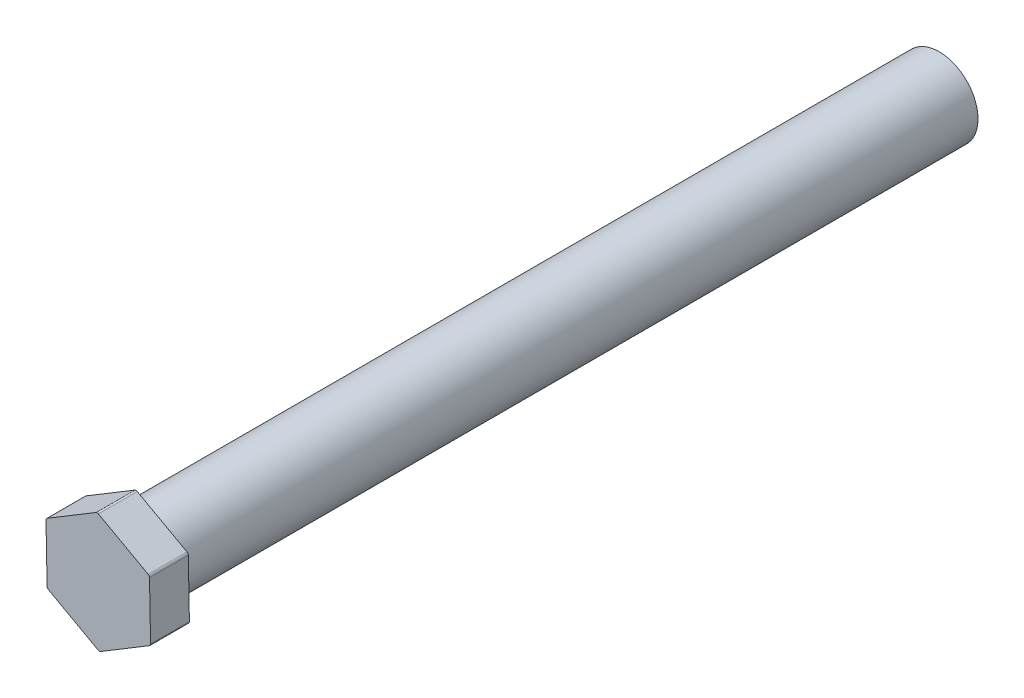
from build123d import *

# Parameters (mm, degrees)
SKETCH1_R           = 3
BOSS_EXTRUDE1_DEPTH = 62
BOSS_EXTRUDE2_DEPTH = 3


with BuildPart() as part:
    # Sketch1 → Boss-Extrude1 (new body)
    with BuildSketch(Plane.XY):
        with Locations((-43.2, 0)):
            Circle(SKETCH1_R)
    extrude(amount=-BOSS_EXTRUDE1_DEPTH)

    # Sketch2 → Boss-Extrude2 (add)
    with BuildSketch(Plane.XY):
        with BuildLine():
            Line((-47.054399712, -2.442285905), (-43.212081089, -4.563004671))
            ThreePointArc((-43.212081089, -4.563004671), (-43.111583363, -4.58786779), (-43.012118219, -4.559151019))
            Line((-43.012118219, -4.559151019), (-39.254362582, -2.291964865))
            ThreePointArc((-39.254362582, -2.291964865), (-39.182581626, -2.217362841), (-39.157718507, -2.116865114))
            Line((-39.157718507, -2.116865114), (-39.242281493, 2.271039806))
            ThreePointArc((-39.242281493, 2.271039806), (-39.270998264, 2.370504949), (-39.345600288, 2.442285905))
            Line((-39.345600288, 2.442285905), (-43.187918911, 4.563004671))
            ThreePointArc((-43.187918911, 4.563004671), (-43.288416637, 4.58786779), (-43.387881781, 4.559151019))
            Line((-43.387881781, 4.559151019), (-47.145637418, 2.291964865))
            ThreePointArc((-47.145637418, 2.291964865), (-47.217418374, 2.217362841), (-47.242281493, 2.116865114))
            Line((-47.242281493, 2.116865114), (-47.157718507, -2.271039806))
            ThreePointArc((-47.157718507, -2.271039806), (-47.129001736, -2.370504949), (-47.054399712, -2.442285905))
        make_face()
    extrude(amount=BOSS_EXTRUDE2_DEPTH)


solid = part.part
